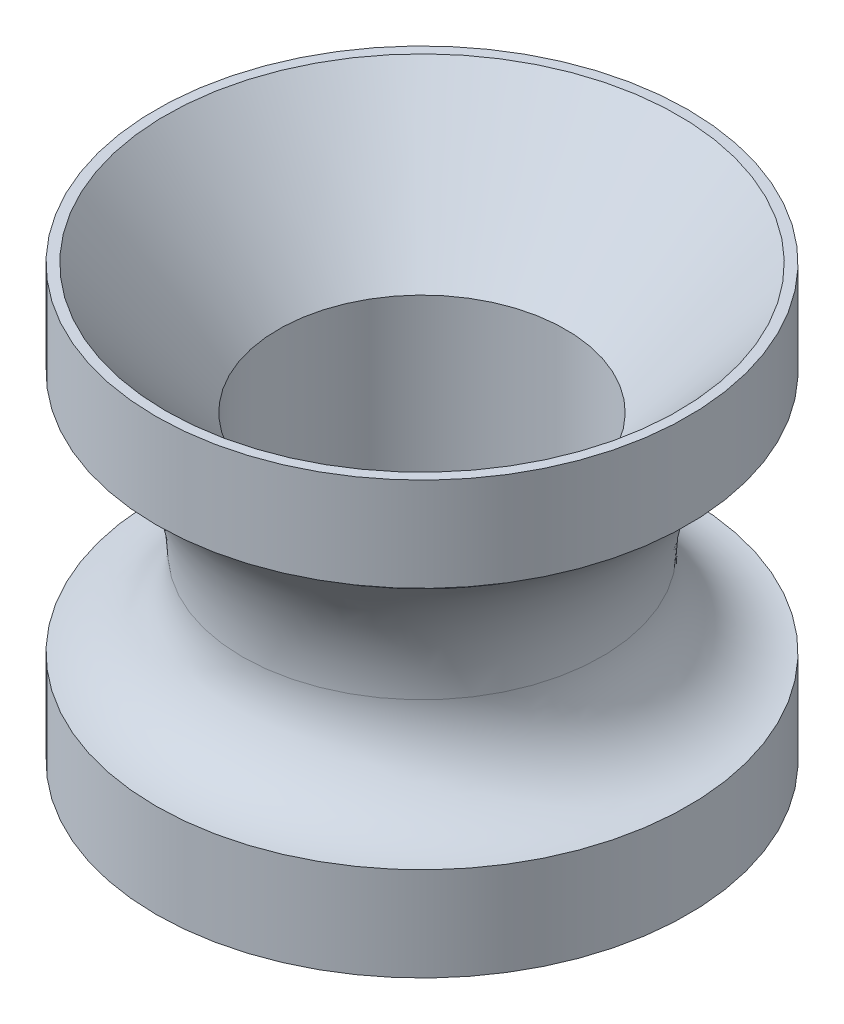
from build123d import *


with BuildPart() as part:
    # Sketch1 → Revolve1 (revolve)
    with BuildSketch(Plane.XY, mode=Mode.PRIVATE) as revolve1_sk:
        with BuildLine():
            Line((0, 0), (4.699, 0))
            Line((4.699, 0), (4.699, 1.656784628))
            ThreePointArc((4.699, 1.656784628), (3.621369312, 2.103153847), (3.175, 3.180784498))
            ThreePointArc((3.175, 3.180784498), (3.580954352, 4.767014148), (4.699, 5.963215372))
            Line((4.699, 5.963215372), (4.699, 7.62))
            Line((4.699, 7.62), (0, 7.62))
            Line((0, 7.62), (0, 0))
        make_face()
    revolve(revolve1_sk.sketch.rotate(Axis((0, 7.62, 0), (0, -1, 0)), 90), axis=Axis((0, 7.62, 0), (0, -1, 0)))

    # Sketch2 → Cut-Revolve1 (revolve, cut)
    with BuildSketch(Plane.XY, mode=Mode.PRIVATE) as cut_revolve1_sk:
        Polygon((0, 0), (2.54, 0), (2.54, 5.334), (4.527189483, 7.62), (0, 7.62), align=None)
    revolve(cut_revolve1_sk.sketch.rotate(Axis((0, 7.62, 0), (0, -1, 0)), 90), axis=Axis((0, 7.62, 0), (0, -1, 0)), mode=Mode.SUBTRACT)


solid = part.part
